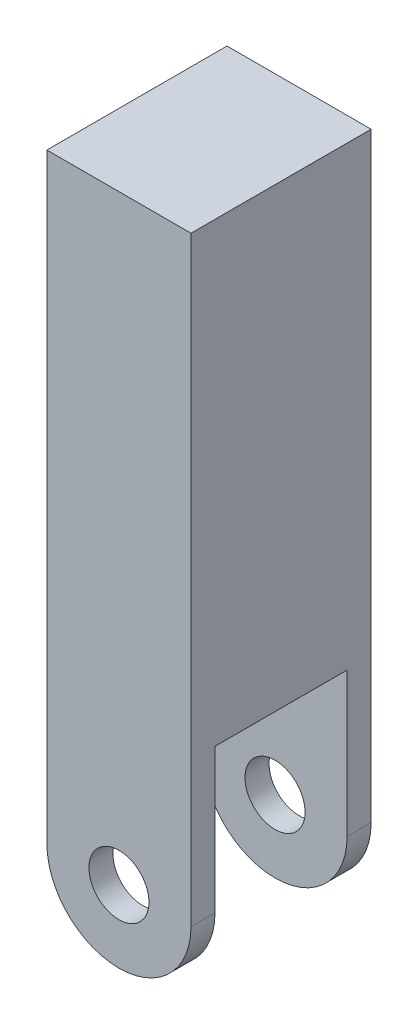
from build123d import *

# Parameters (mm, degrees)
SKETCH1_R               = 2.5
BOSS_EXTRUDE2_DEPTH     = 7.5
CUT_EXTRUDE1_DEPTH      = 51.914143418
CUT_EXTRUDE1_DEPTH_BACK = 51.914143418
SKETCH2_W               = 11
SKETCH2_H               = 34.501138588


with BuildPart() as part:
    # Sketch1 → Boss-Extrude2 (new, symmetric)
    with BuildSketch(Plane.XY):
        with BuildLine():
            Line((-6, 0), (-6, 50))
            Line((-6, 50), (6, 50))
            Line((6, 50), (6, 0))
            ThreePointArc((6, 0), (0, -6), (-6, 0))
        make_face()
        Circle(SKETCH1_R, mode=Mode.SUBTRACT)
    extrude(amount=BOSS_EXTRUDE2_DEPTH, both=True)

    # Sketch2 → Cut-Extrude1 (cut, two sides: drawn at the far end of the back side and taken through both)
    with BuildSketch(Plane(origin=(0, 0, 0), x_dir=(0, 0, -1), z_dir=(1, 0, 0)).offset(-CUT_EXTRUDE1_DEPTH_BACK)):
        with Locations((0, -5.250569294)):
            Rectangle(SKETCH2_W, SKETCH2_H)
    extrude(amount=CUT_EXTRUDE1_DEPTH + CUT_EXTRUDE1_DEPTH_BACK, mode=Mode.SUBTRACT)


solid = part.part
